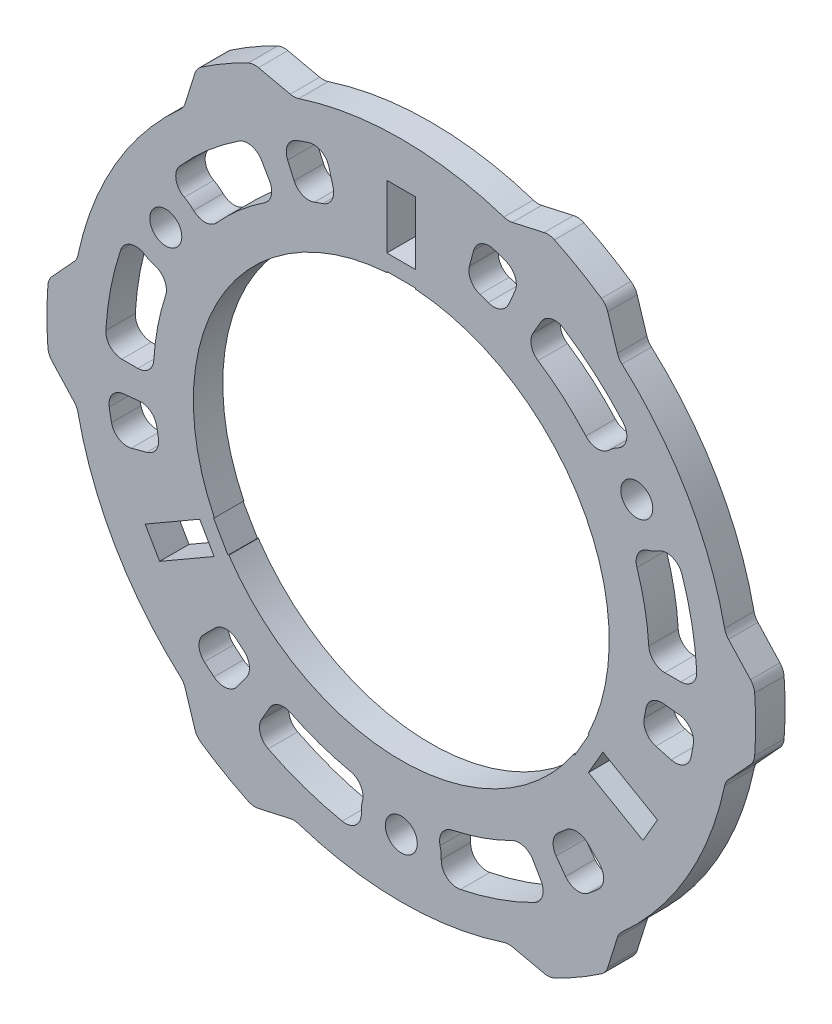
from build123d import *

# Parameters (mm, degrees)
SKETCH1_R           = 65.0875
SKETCH1_W           = 5.742
SKETCH1_H           = 12.5
BOSS_EXTRUDE1_DEPTH = 5.842
CUT_EXTRUDE2_DEPTH  = 93.232826458
FILLET1_R           = 3.175
BOSS_EXTRUDE2_START = -5.842
SKETCH4_R           = 65.5875
SKETCH4_R_2         = 65.0875
BOSS_EXTRUDE2_DEPTH = 5.842
SKETCH5_R           = 7.9375
SKETCH5_R_2         = 3.175
BOSS_EXTRUDE3_DEPTH = 5.842
SKETCH6_R           = 3.175
CUT_EXTRUDE3_DEPTH  = 93.938524179
FILLET2_R           = 3.175
BOSS_EXTRUDE4_START = -5.842
BOSS_EXTRUDE4_DEPTH = 5.842
FILLET3_R           = 3.175


with BuildPart() as part:
    # Sketch1 → Boss-Extrude1 (new body)
    with BuildSketch(Plane.XY):
        Circle(SKETCH1_R)
        Polygon((47.971249286, -31.011358934), (50.842249286, -26.038641066), (40.016931739, -19.788641066), (37.145931739, -24.761358934), align=None, mode=Mode.SUBTRACT)
        with Locations((0, 50.8)):
            Rectangle(SKETCH1_W, SKETCH1_H, mode=Mode.SUBTRACT)
        Polygon((-50.842249286, -26.038641066), (-47.971249286, -31.011358934), (-37.145931739, -24.761358934), (-40.016931739, -19.788641066), align=None, mode=Mode.SUBTRACT)
        with BuildLine():
            Line((-2.871, 41.375), (2.871, 41.375))
            Line((2.871, 41.375), (2.871, 41.175028646))
            ThreePointArc((2.871, 41.175028646), (35.745198541, 20.6375), (37.094120809, -18.101155389))
            Line((37.094120809, -18.101155389), (37.267301082, -18.201141066))
            Line((37.267301082, -18.201141066), (34.396301082, -23.173858934))
            Line((34.396301082, -23.173858934), (34.223120809, -23.073873257))
            ThreePointArc((34.223120809, -23.073873257), (0, -41.275), (-34.223120809, -23.073873257))
            Line((-34.223120809, -23.073873257), (-34.396301082, -23.173858934))
            Line((-34.396301082, -23.173858934), (-37.267301082, -18.201141066))
            Line((-37.267301082, -18.201141066), (-37.094120809, -18.101155389))
            ThreePointArc((-37.094120809, -18.101155389), (-35.745198541, 20.6375), (-2.871, 41.175028646))
            Line((-2.871, 41.175028646), (-2.871, 41.375))
        make_face(mode=Mode.SUBTRACT)
    extrude(amount=BOSS_EXTRUDE1_DEPTH)

    # Sketch3 → Cut-Extrude2 (cut, through all)
    with BuildSketch(Plane.XY.offset(5.842)):
        with BuildLine():
            ThreePointArc((-24.60625, 42.619275184), (-33.875649556, 35.697486233), (-41.273075325, 26.803048511))
            Line((-41.273075325, 26.803048511), (-49.261412485, 31.990735319))
            ThreePointArc((-49.261412485, 31.990735319), (-40.43222689, 42.606677117), (-29.36875, 50.868167155))
            Line((-29.36875, 50.868167155), (-24.60625, 42.619275184))
        make_face()
        with BuildLine():
            Line((-43.848658572, 22.342007468), (-52.335495715, 26.666266978))
            ThreePointArc((-52.335495715, 26.666266978), (-57.114578199, 13.711997059), (-58.7375, 0))
            Line((-58.7375, 0), (-49.2125, 0))
            ThreePointArc((-49.2125, 0), (-47.852754708, 11.488429969), (-43.848658572, 22.342007468))
        make_face()
        with BuildLine():
            Line((-56.736068222, -15.202383662), (-47.535624726, -12.737132257))
            ThreePointArc((-47.535624726, -12.737132257), (-48.388432138, -8.968265798), (-48.942908776, -5.144106999))
            Line((-48.942908776, -5.144106999), (-58.415729829, -6.139740611))
            ThreePointArc((-58.415729829, -6.139740611), (-57.753935133, -10.704059179), (-56.736068222, -15.202383662))
        make_face()
        with BuildLine():
            Line((-15.202383662, 56.736068222), (-12.737132257, 47.535624726))
            ThreePointArc((-12.737132257, 47.535624726), (-16.42747006, 46.38974438), (-20.016527047, 44.957855834))
            Line((-20.016527047, 44.957855834), (-23.890693573, 53.659376318))
            ThreePointArc((-23.890693573, 53.659376318), (-19.606980394, 55.368404583), (-15.202383662, 56.736068222))
        make_face()
        with BuildLine():
            Line((15.202383662, 56.736068222), (12.737132257, 47.535624726))
            ThreePointArc((12.737132257, 47.535624726), (16.42747006, 46.38974438), (20.016527047, 44.957855834))
            Line((20.016527047, 44.957855834), (23.890693573, 53.659376318))
            ThreePointArc((23.890693573, 53.659376318), (19.606980394, 55.368404583), (15.202383662, 56.736068222))
        make_face()
        with BuildLine():
            ThreePointArc((41.273075325, 26.803048511), (33.875649556, 35.697486233), (24.60625, 42.619275184))
            Line((24.60625, 42.619275184), (29.36875, 50.868167155))
            ThreePointArc((29.36875, 50.868167155), (40.43222689, 42.606677117), (49.261412485, 31.990735319))
            Line((49.261412485, 31.990735319), (41.273075325, 26.803048511))
        make_face()
        with BuildLine():
            ThreePointArc((49.2125, 0), (47.852754708, 11.488429969), (43.848658572, 22.342007468))
            Line((43.848658572, 22.342007468), (52.335495715, 26.666266978))
            ThreePointArc((52.335495715, 26.666266978), (57.114578199, 13.711997059), (58.7375, 0))
            Line((58.7375, 0), (49.2125, 0))
        make_face()
        with BuildLine():
            ThreePointArc((47.535624726, -12.737132257), (48.388432138, -8.968265798), (48.942908776, -5.144106999))
            Line((48.942908776, -5.144106999), (58.415729829, -6.139740611))
            ThreePointArc((58.415729829, -6.139740611), (57.753935133, -10.704059179), (56.736068222, -15.202383662))
            Line((56.736068222, -15.202383662), (47.535624726, -12.737132257))
        make_face()
        with BuildLine():
            Line((41.53368456, -41.53368456), (34.798492469, -34.798492469))
            ThreePointArc((34.798492469, -34.798492469), (31.960962078, -37.421478582), (28.926381728, -39.813748836))
            Line((28.926381728, -39.813748836), (34.525036257, -47.519635707))
            ThreePointArc((34.525036257, -47.519635707), (38.146954739, -44.664345404), (41.53368456, -41.53368456))
        make_face()
        with BuildLine():
            ThreePointArc((2.575583247, -49.145055979), (13.977105151, -47.185916202), (24.60625, -42.619275184))
            Line((24.60625, -42.619275184), (29.36875, -50.868167155))
            ThreePointArc((29.36875, -50.868167155), (16.68235131, -56.318674177), (3.07408323, -58.657002298))
            Line((3.07408323, -58.657002298), (2.575583247, -49.145055979))
        make_face()
        with BuildLine():
            ThreePointArc((-24.60625, -42.619275184), (-13.977105151, -47.185916202), (-2.575583247, -49.145055979))
            Line((-2.575583247, -49.145055979), (-3.07408323, -58.657002298))
            ThreePointArc((-3.07408323, -58.657002298), (-16.68235131, -56.318674177), (-29.36875, -50.868167155))
            Line((-29.36875, -50.868167155), (-24.60625, -42.619275184))
        make_face()
        with BuildLine():
            ThreePointArc((-34.798492469, -34.798492469), (-31.960962078, -37.421478582), (-28.926381728, -39.813748836))
            Line((-28.926381728, -39.813748836), (-34.525036257, -47.519635707))
            ThreePointArc((-34.525036257, -47.519635707), (-38.146954739, -44.664345404), (-41.53368456, -41.53368456))
            Line((-41.53368456, -41.53368456), (-34.798492469, -34.798492469))
        make_face()
    extrude(amount=-CUT_EXTRUDE2_DEPTH, mode=Mode.SUBTRACT)

    # Fillet1
    fillet1_edges = [part.edges().sort_by_distance(p)[0] for p in [
        (-52.335495715, 26.666266978, 2.921),
        (-43.848658572, 22.342007468, 2.921),
        (-49.2125, 0, 2.921),
        (-58.7375, 0, 2.921),
        (-47.535624726, -12.737132257, 2.921),
        (-56.736068222, -15.202383662, 2.921),
        (-58.415729829, -6.139740611, 2.921),
        (-48.942908776, -5.144106999, 2.921),
        (-15.202383662, 56.736068222, 2.921),
        (-12.737132257, 47.535624726, 2.921),
        (-20.016527047, 44.957855834, 2.921),
        (-23.890693573, 53.659376318, 2.921),
        (12.737132257, 47.535624726, 2.921),
        (15.202383662, 56.736068222, 2.921),
        (23.890693573, 53.659376318, 2.921),
        (20.016527047, 44.957855834, 2.921),
        (41.273075325, 26.803048511, 2.921),
        (24.60625, 42.619275184, 2.921),
        (29.36875, 50.868167155, 2.921),
        (49.261412485, 31.990735319, 2.921),
        (49.2125, 0, 2.921),
        (43.848658572, 22.342007468, 2.921),
        (52.335495715, 26.666266978, 2.921),
        (58.7375, 0, 2.921),
        (47.535624726, -12.737132257, 2.921),
        (48.942908776, -5.144106999, 2.921),
        (58.415729829, -6.139740611, 2.921),
        (56.736068222, -15.202383662, 2.921),
        (34.798492469, -34.798492469, 2.921),
        (41.53368456, -41.53368456, 2.921),
        (34.525036257, -47.519635707, 2.921),
        (28.926381728, -39.813748836, 2.921),
        (2.575583247, -49.145055979, 2.921),
        (24.60625, -42.619275184, 2.921),
        (29.36875, -50.868167155, 2.921),
        (3.07408323, -58.657002298, 2.921),
        (-24.60625, -42.619275184, 2.921),
        (-2.575583247, -49.145055979, 2.921),
        (-3.07408323, -58.657002298, 2.921),
        (-29.36875, -50.868167155, 2.921),
        (-34.798492469, -34.798492469, 2.921),
        (-28.926381728, -39.813748836, 2.921),
        (-34.525036257, -47.519635707, 2.921),
        (-41.53368456, -41.53368456, 2.921),
        (-24.60625, 42.619275184, 2.921),
        (-41.273075325, 26.803048511, 2.921),
        (-49.261412485, 31.990735319, 2.921),
        (-29.36875, 50.868167155, 2.921),
    ]]
    fillet(fillet1_edges, radius=FILLET1_R)

    # Sketch4 → Boss-Extrude2 (add)
    with BuildSketch(Plane.XY.offset(5.842).offset(BOSS_EXTRUDE2_START)):
        Circle(SKETCH4_R)
        Circle(SKETCH4_R_2, mode=Mode.SUBTRACT)
    extrude(amount=BOSS_EXTRUDE2_DEPTH)

    # Sketch5 → Boss-Extrude3 (add)
    # profile 1 of 3: a face of its own
    with BuildSketch(Plane.XY.offset(5.842)):
        with Locations((46.743721169, 26.9875)):
            Circle(SKETCH5_R)
        with Locations((46.743721169, 26.9875)):
            Circle(SKETCH5_R_2, mode=Mode.SUBTRACT)
    # profile 2 of 3: a face of its own
    with BuildSketch(Plane.XY.offset(5.842)):
        with Locations((0, -53.975)):
            Circle(SKETCH5_R)
        with Locations((0, -53.975)):
            Circle(SKETCH5_R_2, mode=Mode.SUBTRACT)
    # profile 3 of 3: a face of its own
    with BuildSketch(Plane.XY.offset(5.842)):
        with Locations((-46.743721169, 26.9875)):
            Circle(SKETCH5_R)
        with Locations((-46.743721169, 26.9875)):
            Circle(SKETCH5_R_2, mode=Mode.SUBTRACT)
    extrude(amount=-BOSS_EXTRUDE3_DEPTH)

    # Sketch6 → Cut-Extrude3 (cut, through all)
    with BuildSketch(Plane.XY.offset(5.842)):
        with Locations((46.743721169, 26.9875)):
            Circle(SKETCH6_R)
        with Locations((0, -53.975)):
            Circle(SKETCH6_R)
        with Locations((-46.743721169, 26.9875)):
            Circle(SKETCH6_R)
    extrude(amount=-CUT_EXTRUDE3_DEPTH, mode=Mode.SUBTRACT)

    # Fillet2
    fillet2_edges = [part.edges().sort_by_distance(p)[0] for p in [
        (53.85152423, 23.454365145, 2.921),
        (39.269855148, 29.660556854, 2.921),
        (47.23783816, 34.909605443, 2.921),
        (45.3217233, 19.178413734, 2.921),
        (-6.613686069, -58.363970588, 2.921),
        (6.051868152, -48.838970588, 2.921),
        (6.613686069, -58.363970588, 2.921),
        (-6.051868152, -48.838970588, 2.921),
        (-53.85152423, 23.454365145, 2.921),
        (-39.269855148, 29.660556854, 2.921),
        (-47.23783816, 34.909605443, 2.921),
        (-45.3217233, 19.178413734, 2.921),
    ]]
    fillet(fillet2_edges, radius=FILLET2_R)

    # Sketch7 → Boss-Extrude4 (add)
    with BuildSketch(Plane.XY.offset(5.842).offset(BOSS_EXTRUDE4_START)):
        with BuildLine():
            Line((29.404794392, 63.909941064), (21.174564558, 62.075421642))
            ThreePointArc((21.174564558, 62.075421642), (32.79375, 56.800441171), (43.171609814, 49.375421642))
            Line((43.171609814, 49.375421642), (40.64523532, 57.420269468))
            ThreePointArc((40.64523532, 57.420269468), (35.175, 60.924887156), (29.404794392, 63.909941064))
        make_face()
        with BuildLine():
            Line((70.050029712, 6.489671595), (64.346174372, 12.7))
            ThreePointArc((64.346174372, 12.7), (65.5875, 0), (64.346174372, -12.7))
            Line((64.346174372, -12.7), (70.050029712, -6.489671595))
            ThreePointArc((70.050029712, -6.489671595), (70.35, 0), (70.050029712, 6.489671595))
        make_face()
        with BuildLine():
            Line((40.64523532, -57.420269468), (43.171609814, -49.375421642))
            ThreePointArc((43.171609814, -49.375421642), (32.79375, -56.800441171), (21.174564558, -62.075421642))
            Line((21.174564558, -62.075421642), (29.404794392, -63.909941064))
            ThreePointArc((29.404794392, -63.909941064), (35.175, -60.924887156), (40.64523532, -57.420269468))
        make_face()
        with BuildLine():
            Line((-29.404794392, -63.909941064), (-21.174564558, -62.075421642))
            ThreePointArc((-21.174564558, -62.075421642), (-32.79375, -56.800441171), (-43.171609814, -49.375421642))
            Line((-43.171609814, -49.375421642), (-40.64523532, -57.420269468))
            ThreePointArc((-40.64523532, -57.420269468), (-35.175, -60.924887156), (-29.404794392, -63.909941064))
        make_face()
        with BuildLine():
            Line((-70.050029712, -6.489671595), (-64.346174372, -12.7))
            ThreePointArc((-64.346174372, -12.7), (-65.5875, 0), (-64.346174372, 12.7))
            Line((-64.346174372, 12.7), (-70.050029712, 6.489671595))
            ThreePointArc((-70.050029712, 6.489671595), (-70.35, 0), (-70.050029712, -6.489671595))
        make_face()
        with BuildLine():
            Line((-40.64523532, 57.420269468), (-43.171609814, 49.375421642))
            ThreePointArc((-43.171609814, 49.375421642), (-32.79375, 56.800441171), (-21.174564558, 62.075421642))
            Line((-21.174564558, 62.075421642), (-29.404794392, 63.909941064))
            ThreePointArc((-29.404794392, 63.909941064), (-35.175, 60.924887156), (-40.64523532, 57.420269468))
        make_face()
    extrude(amount=BOSS_EXTRUDE4_DEPTH)

    # Fillet3
    fillet3_edges = [part.edges().sort_by_distance(p)[0] for p in [
        (29.404794392, 63.909941064, 2.921),
        (40.64523532, 57.420269468, 2.921),
        (43.171609814, 49.375421642, 2.921),
        (21.174564558, 62.075421642, 2.921),
        (70.050029712, 6.489671595, 2.921),
        (70.050029712, -6.489671595, 2.921),
        (64.346174372, -12.7, 2.921),
        (64.346174372, 12.7, 2.921),
        (40.64523532, -57.420269468, 2.921),
        (29.404794392, -63.909941064, 2.921),
        (21.174564558, -62.075421642, 2.921),
        (43.171609814, -49.375421642, 2.921),
        (-29.404794392, -63.909941064, 2.921),
        (-40.64523532, -57.420269468, 2.921),
        (-43.171609814, -49.375421642, 2.921),
        (-21.174564558, -62.075421642, 2.921),
        (-70.050029712, -6.489671595, 2.921),
        (-70.050029712, 6.489671595, 2.921),
        (-64.346174372, 12.7, 2.921),
        (-64.346174372, -12.7, 2.921),
        (-40.64523532, 57.420269468, 2.921),
        (-29.404794392, 63.909941064, 2.921),
        (-21.174564558, 62.075421642, 2.921),
        (-43.171609814, 49.375421642, 2.921),
    ]]
    fillet(fillet3_edges, radius=FILLET3_R)


solid = part.part
